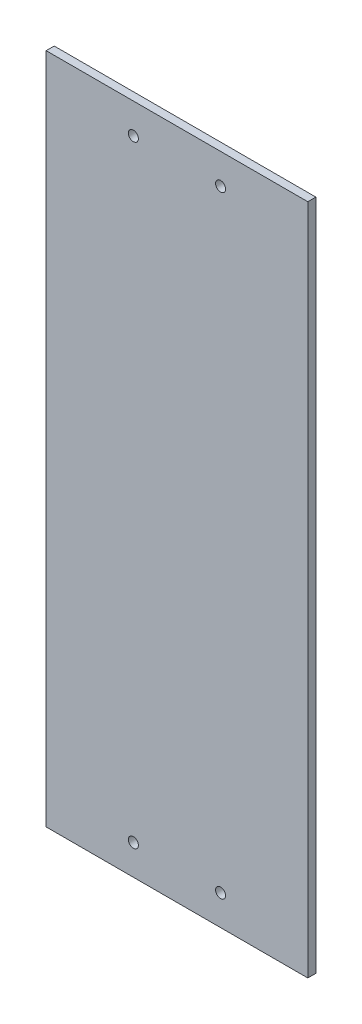
from build123d import *

# Parameters (mm, degrees)
CROQUIS1_W              = 130
CROQUIS1_H              = 334
CROQUIS1_R              = 2.5
SALIENTE_EXTRUIR1_DEPTH = 4


with BuildPart() as part:
    # Croquis1 → Saliente-Extruir1 (new body)
    with BuildSketch(Plane.XY):
        with Locations((-11.323689132, 12.876130384)):
            Rectangle(CROQUIS1_W, CROQUIS1_H)
        with Locations((10.342977535, 164.876130384)):
            Circle(CROQUIS1_R, mode=Mode.SUBTRACT)
        with Locations((-32.990355799, 164.876130384)):
            Circle(CROQUIS1_R, mode=Mode.SUBTRACT)
        with Locations((10.342977535, -139.123869616)):
            Circle(CROQUIS1_R, mode=Mode.SUBTRACT)
        with Locations((-32.990355799, -139.123869616)):
            Circle(CROQUIS1_R, mode=Mode.SUBTRACT)
    extrude(amount=SALIENTE_EXTRUIR1_DEPTH)


solid = part.part
